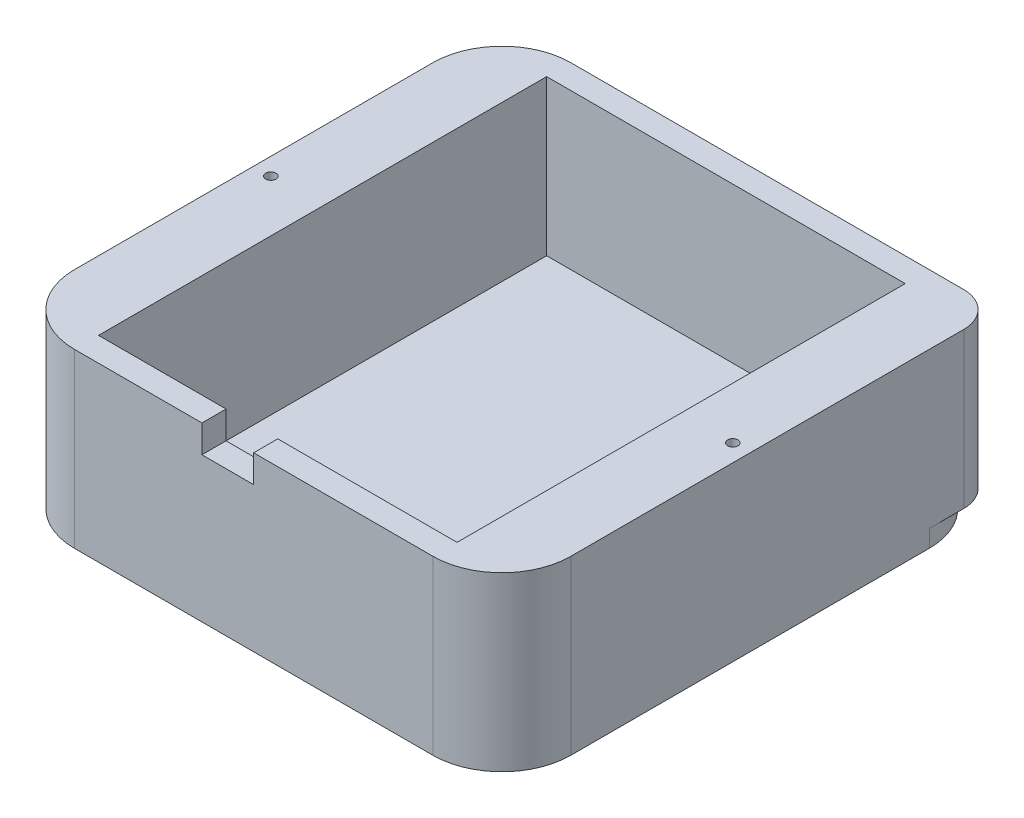
from build123d import *

# Parameters (mm, degrees)
SKETCH1_W           = 144
SKETCH1_H           = 144
BOSS_EXTRUDE1_DEPTH = 5
FILLET1_R           = 20
BOSS_EXTRUDE2_START = 45
SKETCH2_W           = 104
SKETCH2_H           = 130
BOSS_EXTRUDE2_DEPTH = 45
SKETCH3_R           = 1.5
CUT_EXTRUDE1_DEPTH  = 13
SKETCH5_W           = 15
SKETCH5_H           = 8
CUT_EXTRUDE2_DEPTH  = 8


with BuildPart() as part:
    # Sketch1 → Boss-Extrude1 (new body)
    with BuildSketch(Plane(origin=(0, 0, 0), x_dir=(1, 0, 0), z_dir=(0, 1, 0))):
        Rectangle(SKETCH1_W, SKETCH1_H)
    extrude(amount=BOSS_EXTRUDE1_DEPTH)

    # Fillet1
    fillet1_edges = [part.edges().sort_by_distance(p)[0] for p in [
        (72, 2.5, 72),
        (-72, 2.5, 72),
        (-72, 2.5, -72),
        (72, 2.5, -72),
    ]]
    fillet(fillet1_edges, radius=FILLET1_R)

    # Sketch2 → Boss-Extrude2 (add)
    with BuildSketch(Plane(origin=(0, 5, 0), x_dir=(1, 0, 0), z_dir=(0, 1, 0)).offset(BOSS_EXTRUDE2_START)):
        with BuildLine():
            Line((-72, 52), (-72, -52))
            ThreePointArc((-72, -52), (-66.142135624, -66.142135624), (-52, -72))
            Line((-52, -72), (52, -72))
            ThreePointArc((52, -72), (66.142135624, -66.142135624), (72, -52))
            Line((72, -52), (72, 62))
            ThreePointArc((72, 62), (69.071067812, 69.071067812), (62, 72))
            Line((62, 72), (-52, 72))
            ThreePointArc((-52, 72), (-66.142135624, 66.142135624), (-72, 52))
        make_face()
        Rectangle(SKETCH2_W, SKETCH2_H, mode=Mode.SUBTRACT)
    extrude(amount=-BOSS_EXTRUDE2_DEPTH)

    # Sketch3 → Cut-Extrude1 (cut)
    with BuildSketch(Plane(origin=(0, 50, 0), x_dir=(1, 0, 0), z_dir=(0, 1, 0))):
        with Locations(Location((-67, 0, 0), (0, 0, 270))):
            Circle(SKETCH3_R)
        with Locations(Location((67, 0, 0), (0, 0, 270))):
            Circle(SKETCH3_R)
    extrude(amount=-CUT_EXTRUDE1_DEPTH, mode=Mode.SUBTRACT)

    # Sketch5 → Cut-Extrude2 (cut)
    with BuildSketch(Plane.XY.offset(72)):
        with Locations((-7.5, 46)):
            Rectangle(SKETCH5_W, SKETCH5_H)
    extrude(amount=-CUT_EXTRUDE2_DEPTH, mode=Mode.SUBTRACT)


solid = part.part
